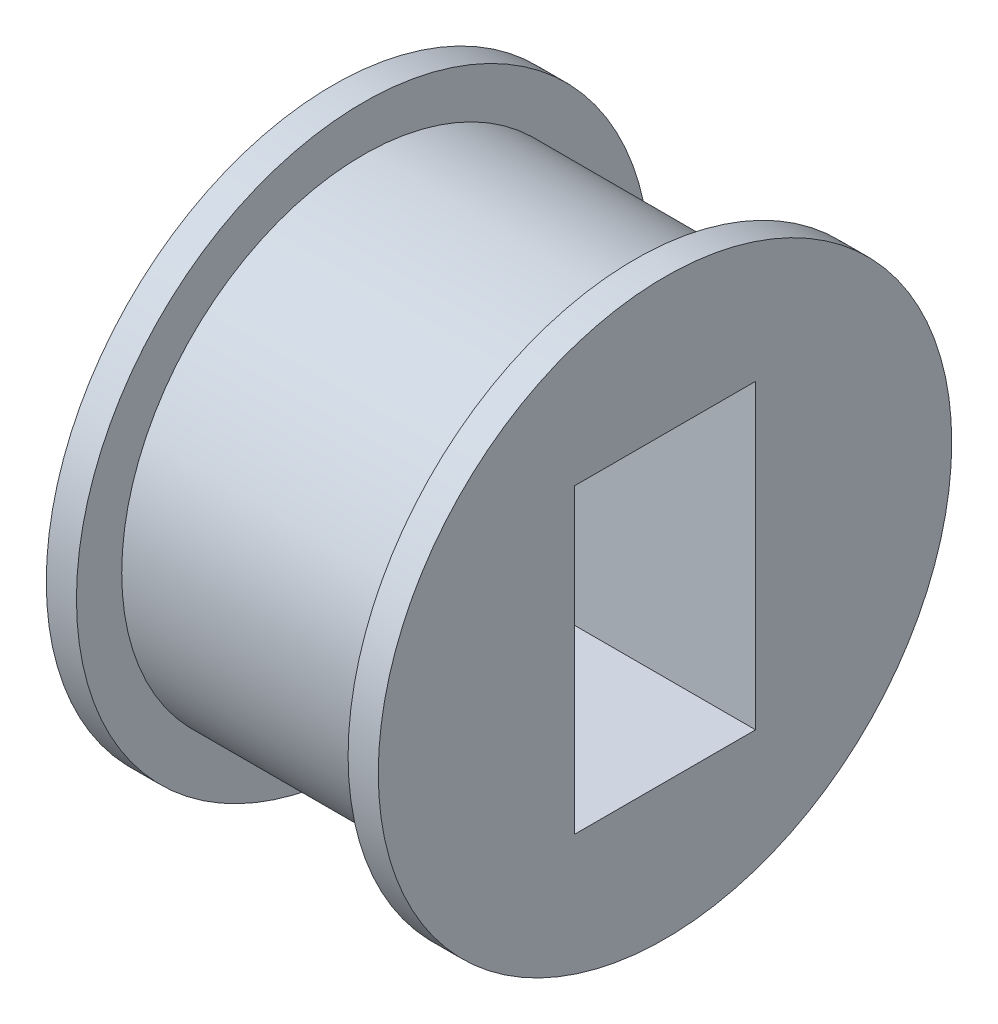
from build123d import *

# Parameters (mm, degrees)
SKETCH2_R               = 40
BOSS_EXTRUDE1_DEPTH     = 25
SKETCH3_R               = 47.5
BOSS_EXTRUDE2_DEPTH     = 2.5
CUT_EXTRUDE1_DEPTH      = 86.256964525
CUT_EXTRUDE1_DEPTH_BACK = 86.256964525
SKETCH4_W               = 30
SKETCH4_H               = 50


with BuildPart() as part:
    # Sketch2 → Boss-Extrude1 (new, symmetric)
    with BuildSketch(Plane(origin=(0, 0, 0), x_dir=(0, 0, -1), z_dir=(1, 0, 0))):
        Circle(SKETCH2_R)
    extrude(amount=BOSS_EXTRUDE1_DEPTH, both=True)

    # Sketch3 → Boss-Extrude2 (add, symmetric)
    with BuildSketch(Plane(origin=(25, 0, 0), x_dir=(0, 0, -1), z_dir=(1, 0, 0))):
        Circle(SKETCH3_R)
    boss_extrude2 = extrude(amount=BOSS_EXTRUDE2_DEPTH, both=True)

    # Mirror1: Boss-Extrude2 across plane
    add(boss_extrude2.mirror(Plane(origin=(0, 0, 0), x_dir=(0, 0, 1), z_dir=(1, 0, 0))))

    # Sketch4 → Cut-Extrude1 (cut, two sides: drawn at the far end of the back side and taken through both)
    with BuildSketch(Plane(origin=(25, 0, 0), x_dir=(0, 0, -1), z_dir=(1, 0, 0)).offset(-CUT_EXTRUDE1_DEPTH_BACK)):
        Rectangle(SKETCH4_W, SKETCH4_H)
    extrude(amount=CUT_EXTRUDE1_DEPTH + CUT_EXTRUDE1_DEPTH_BACK, mode=Mode.SUBTRACT)


solid = part.part
